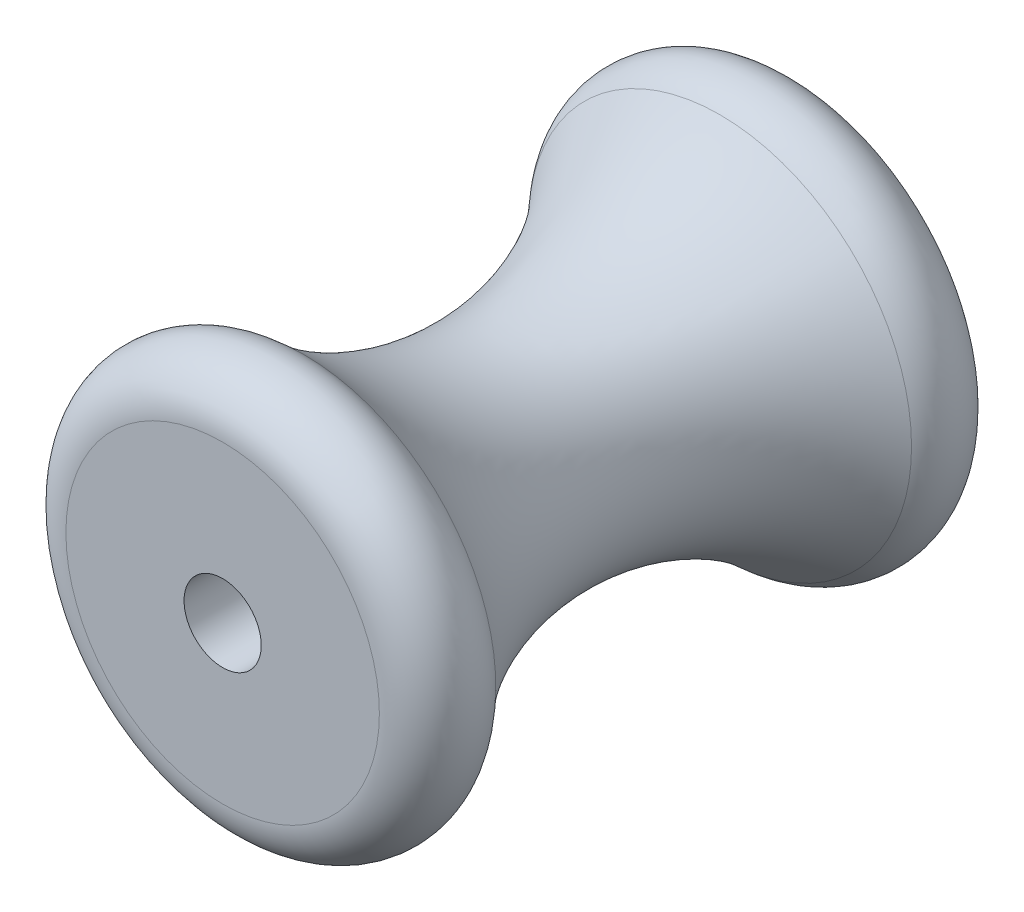
from build123d import *

# Parameters (mm, degrees)
FILLET1_R = 2


with BuildPart() as part:
    # Sketch1 → Revolve1 (revolve)
    with BuildSketch(Plane(origin=(0, 0, 0), x_dir=(0, 0, -1), z_dir=(1, 0, 0))):
        with BuildLine():
            Line((12, 1.6), (12, 13.5))
            ThreePointArc((12, 13.5), (0, 4.5), (-12, 13.5))
            Line((-12, 13.5), (-12, 1.6))
            Line((-12, 1.6), (12, 1.6))
        make_face()
    revolve(axis=Axis((0, 0, -12.5), (0, 0, 1)))

    # Fillet1
    fillet1_edges = [part.edges().sort_by_distance(p)[0] for p in [
        (0, -13.5, 12),
        (0, -13.5, -12),
    ]]
    fillet(fillet1_edges, radius=FILLET1_R)


solid = part.part
